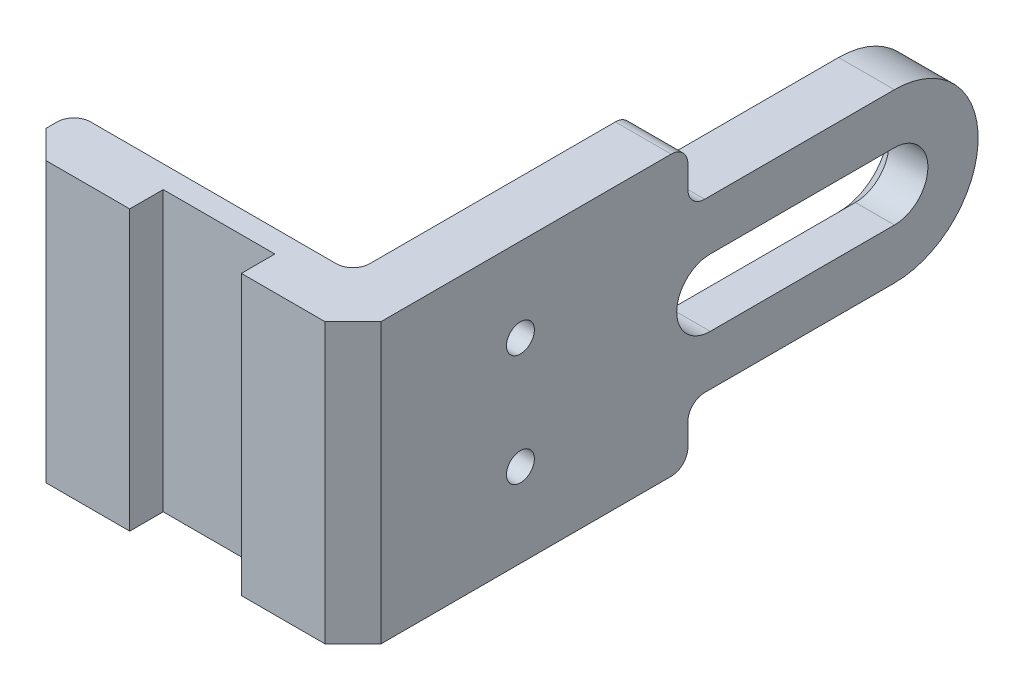
from build123d import *

# Parameters (mm, degrees)
BOSS_EXTRUDE1_DEPTH = 25
CUT_EXTRUDE1_DEPTH  = 25
CUT_EXTRUDE2_DEPTH  = 25
FILLET1_R           = 1.5
SKETCH5_R           = 1.25
CUT_EXTRUDE4_DEPTH  = 25
CUT_EXTRUDE5_START  = -2.5
SKETCH5_4_R         = 3
SKETCH5_4_R_2       = 1.25
CUT_EXTRUDE5_DEPTH  = 2.5
SKETCH7_W           = 10
SKETCH7_H           = 3
CUT_EXTRUDE6_DEPTH  = 69.271516755
CHAMFER1_SIZE       = 2.5
FILLET2_R           = 1.5
CHAMFER2_SIZE       = 1.5


with BuildPart() as part:
    # Sketch1 → Boss-Extrude1 (new body)
    with BuildSketch(Plane(origin=(0, 0, 0), x_dir=(1, 0, 0), z_dir=(0, 1, 0))):
        Polygon((0, 0), (-30, 0), (-30, 5), (-5, 5), (-5, 56), (0, 56), align=None)
    extrude(amount=BOSS_EXTRUDE1_DEPTH)

    # Sketch2 → Cut-Extrude1 (cut)
    with BuildSketch(Plane(origin=(0, 0, 0), x_dir=(0, 0, -1), z_dir=(1, 0, 0))):
        with BuildLine():
            Line((56, 25), (30, 25))
            Line((30, 25), (30, 20))
            Line((30, 20), (48.5, 20))
            ThreePointArc((48.5, 20), (53.803300859, 17.803300859), (56, 12.5))
            Line((56, 12.5), (56, 25))
        make_face()
        with BuildLine():
            ThreePointArc((56, 12.5), (53.803300859, 7.196699141), (48.5, 5))
            Line((48.5, 5), (30, 5))
            Line((30, 5), (30, 0))
            Line((30, 0), (56, 0))
            Line((56, 0), (56, 12.5))
        make_face()
    extrude(amount=-CUT_EXTRUDE1_DEPTH, mode=Mode.SUBTRACT)

    # Sketch3 → Cut-Extrude2 (cut)
    with BuildSketch(Plane(origin=(0, 0, 0), x_dir=(0, 0, -1), z_dir=(1, 0, 0))):
        with BuildLine():
            Line((32, 15.5), (48.5, 15.5))
            ThreePointArc((48.5, 15.5), (51.5, 12.5), (48.5, 9.5))
            Line((48.5, 9.5), (32, 9.5))
            ThreePointArc((32, 9.5), (29, 12.5), (32, 15.5))
        make_face()
    extrude(amount=-CUT_EXTRUDE2_DEPTH, mode=Mode.SUBTRACT)

    # Fillet1
    fillet1_edges = [part.edges().sort_by_distance(p)[0] for p in [
        (-2.5, 20, -30),
        (-2.5, 5, -30),
        (-2.5, 0, -30),
        (-2.5, 25, -30),
    ]]
    fillet(fillet1_edges, radius=FILLET1_R)

    # Sketch5 → Cut-Extrude4 (cut)
    with BuildSketch(Plane(origin=(0, 0, 0), x_dir=(0, 0, -1), z_dir=(1, 0, 0))):
        with Locations((15, 17.5)):
            Circle(SKETCH5_R)
        with Locations((15, 7.5)):
            Circle(SKETCH5_R)
    extrude(amount=-CUT_EXTRUDE4_DEPTH, mode=Mode.SUBTRACT)

    # Sketch5<4> → Cut-Extrude5 (cut)
    # profile 1 of 2: a face of its own
    with BuildSketch(Plane(origin=(0, 0, 0), x_dir=(0, 0, -1), z_dir=(1, 0, 0)).offset(CUT_EXTRUDE5_START)):
        with Locations((15, 17.5)):
            Circle(SKETCH5_4_R)
        with Locations((15, 17.5)):
            Circle(SKETCH5_4_R_2, mode=Mode.SUBTRACT)
    # profile 2 of 2: a face of its own
    with BuildSketch(Plane(origin=(0, 0, 0), x_dir=(0, 0, -1), z_dir=(1, 0, 0)).offset(CUT_EXTRUDE5_START)):
        with Locations((15, 7.5)):
            Circle(SKETCH5_4_R)
        with Locations((15, 7.5)):
            Circle(SKETCH5_4_R_2, mode=Mode.SUBTRACT)
    extrude(amount=-CUT_EXTRUDE5_DEPTH, mode=Mode.SUBTRACT)

    # Sketch7 → Cut-Extrude6 (cut, through all)
    with BuildSketch(Plane(origin=(0, 25, 0), x_dir=(1, 0, 0), z_dir=(0, 1, 0))):
        with Locations((-15, 1.5)):
            Rectangle(SKETCH7_W, SKETCH7_H)
    extrude(amount=-CUT_EXTRUDE6_DEPTH, mode=Mode.SUBTRACT)

    # Chamfer1
    chamfer1_edges = [part.edges().sort_by_distance(p)[0] for p in [
        (0, 12.5, 0),
        (-30, 12.5, 0),
    ]]
    chamfer(chamfer1_edges, length=CHAMFER1_SIZE)

    # Fillet2
    fillet2_edges = [part.edges().sort_by_distance(p)[0] for p in [
        (-30, 12.5, -5),
        (-5, 12.5, -5),
    ]]
    fillet(fillet2_edges, radius=FILLET2_R)

    # Chamfer2
    chamfer2_edges = [part.edges().sort_by_distance(p)[0] for p in [
        (-5, 9.5, -40.25),
        (-5, 12.5, -51.5),
        (-5, 12.5, -29),
        (-5, 15.5, -40.25),
    ]]
    chamfer(chamfer2_edges, length=CHAMFER2_SIZE)


solid = part.part
